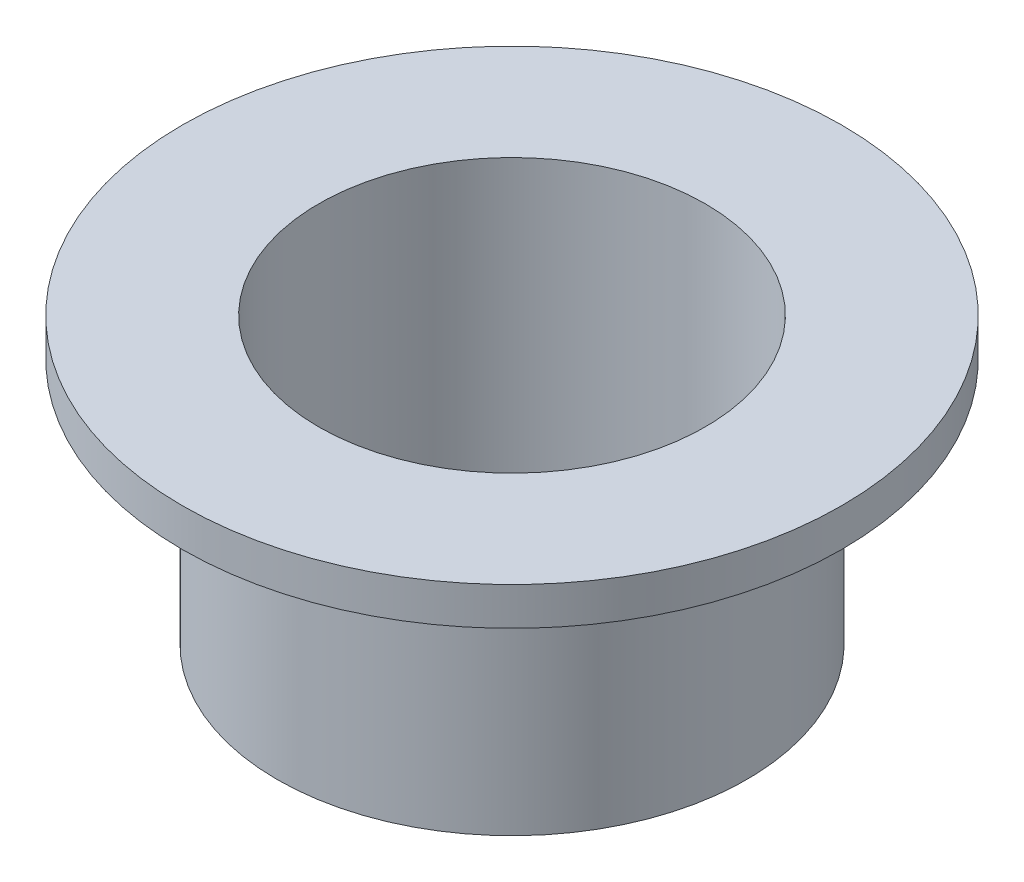
from build123d import *


with BuildPart() as part:
    # Sketch1 → Revolve1 (revolve)
    with BuildSketch(Plane.XY, mode=Mode.PRIVATE) as revolve1_sk:
        Polygon((10.1875, -15), (12.375, -15), (12.375, -2), (17.375, -2), (17.375, 0), (10.1875, 0), align=None)
    revolve(revolve1_sk.sketch.rotate(Axis((0, 0, 0), (0, 1, 0)), 90), axis=Axis((0, 0, 0), (0, 1, 0)))


solid = part.part
